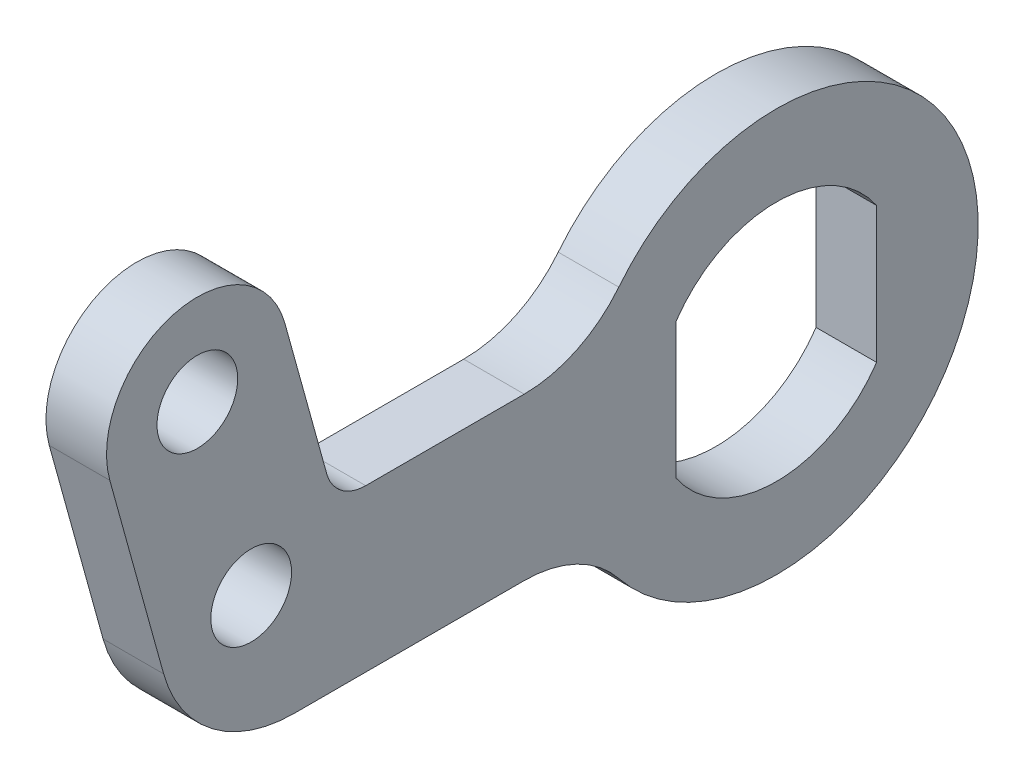
from build123d import *

# Parameters (mm, degrees)
SKETCH1_R           = 1
BOSS_EXTRUDE3_DEPTH = 1.5


with BuildPart() as part:
    # Sketch1 → Boss-Extrude3 (new body)
    with BuildSketch(Plane(origin=(0, 0, 0), x_dir=(0, 0, -1), z_dir=(1, 0, 0))):
        with BuildLine():
            Line((6.7641026, 1.999999498), (2.83655563, 1.999999498))
            ThreePointArc((2.83655563, 1.999999498), (2.231030071, 2.20417364), (1.872769834, 2.733321904))
            Line((1.872769834, 2.733321904), (0.835129535, 6.483404419))
            ThreePointArc((0.835129535, 6.483404419), (-1.933413156, 8.051897856), (-3.501906514, 5.283355121))
            Line((-3.501906514, 5.283355121), (-2.168518496, 0.464427051))
            ThreePointArc((-2.168518496, 0.464427051), (-0.964537658, -1.313845406), (1.07041083, -1.999999498))
            Line((1.07041083, -1.999999498), (6.7641026, -1.999999498))
            ThreePointArc((6.7641026, -1.999999498), (8.063140814, -2.295836094), (9.105977, -3.124999686))
            ThreePointArc((9.105977, -3.124999686), (18.009101, 0), (9.105977, 3.124999686))
            ThreePointArc((9.105977, 3.124999686), (8.063140814, 2.295836094), (6.7641026, 1.999999498))
        make_face()
        with Locations((-1.333388507, 5.883379832)):
            Circle(SKETCH1_R, mode=Mode.SUBTRACT)
        with Locations((0, 1.064451)):
            Circle(SKETCH1_R, mode=Mode.SUBTRACT)
        with BuildLine():
            Line((10.525768, 1.683168801), (10.525768, -1.683168801))
            ThreePointArc((10.525768, -1.683168801), (13.009101, -3), (15.492434, -1.683168801))
            Line((15.492434, -1.683168801), (15.492434, 1.683168801))
            ThreePointArc((15.492434, 1.683168801), (13.009101, 3), (10.525768, 1.683168801))
        make_face(mode=Mode.SUBTRACT)
    extrude(amount=BOSS_EXTRUDE3_DEPTH)


solid = part.part
